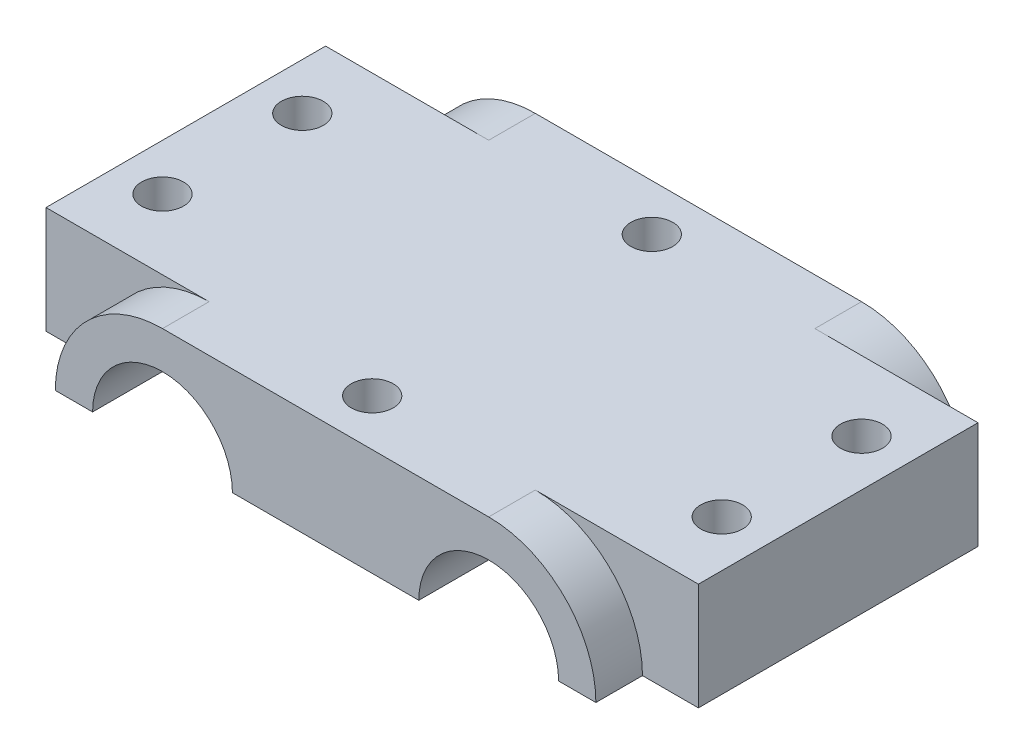
from build123d import *

# Parameters (mm, degrees)
SKETCH1_W           = 70
SKETCH1_H           = 11.5
BOSS_EXTRUDE1_DEPTH = 20
CUT_EXTRUDE1_DEPTH  = 54.460850162
CUT_EXTRUDE2_DEPTH  = 5
HOLE1_D             = 4.5
HOLE2_D             = 4.5


with BuildPart() as part:
    # Sketch1 → Boss-Extrude1 (new, symmetric)
    with BuildSketch(Plane.XY):
        Rectangle(SKETCH1_W, SKETCH1_H)
    extrude(amount=BOSS_EXTRUDE1_DEPTH, both=True)

    # Sketch2 → Cut-Extrude1 (cut, through all)
    with BuildSketch(Plane.XY.offset(20)):
        with BuildLine():
            Line((-25, -5.75), (-10, -5.75))
            ThreePointArc((-10, -5.75), (-17.5, 1.75), (-25, -5.75))
        make_face()
        with BuildLine():
            Line((10, -5.75), (25, -5.75))
            ThreePointArc((25, -5.75), (17.5, 1.75), (10, -5.75))
        make_face()
    extrude(amount=-CUT_EXTRUDE1_DEPTH, mode=Mode.SUBTRACT)

    # Sketch3 → Cut-Extrude2 (cut)
    with BuildSketch(Plane.XY.offset(20)):
        with BuildLine():
            Line((-35, 5.75), (-35, -5.75))
            Line((-35, -5.75), (-29, -5.75))
            ThreePointArc((-29, -5.75), (-25.631727984, 2.381727984), (-17.5, 5.75))
            Line((-17.5, 5.75), (-35, 5.75))
        make_face()
        with BuildLine():
            Line((35, -5.75), (35, 5.75))
            Line((35, 5.75), (17.5, 5.75))
            ThreePointArc((17.5, 5.75), (25.631727984, 2.381727984), (29, -5.75))
            Line((29, -5.75), (35, -5.75))
        make_face()
    cut_extrude2 = extrude(amount=-CUT_EXTRUDE2_DEPTH, mode=Mode.SUBTRACT)

    # Mirror1: Cut-Extrude2 across plane
    add(cut_extrude2.mirror(Plane.XY), mode=Mode.SUBTRACT)

    # Hole1 (through all)
    with Locations(Plane(origin=(0, 5.75, 0), x_dir=(1, 0, 0), z_dir=(0, 1, 0))):
        with Locations((30, -7.5), (30, 7.5)):
            hole1 = Hole(HOLE1_D / 2)

    # Mirror2: Hole1 across plane
    add(hole1.mirror(Plane(origin=(0, 0, 0), x_dir=(0, 0, 1), z_dir=(1, 0, 0))), mode=Mode.SUBTRACT)

    # Hole2 (through all)
    with Locations(Plane(origin=(0, 5.75, 0), x_dir=(1, 0, 0), z_dir=(0, 1, 0))):
        with Locations((0, 15), (0, -15)):
            Hole(HOLE2_D / 2)


solid = part.part
